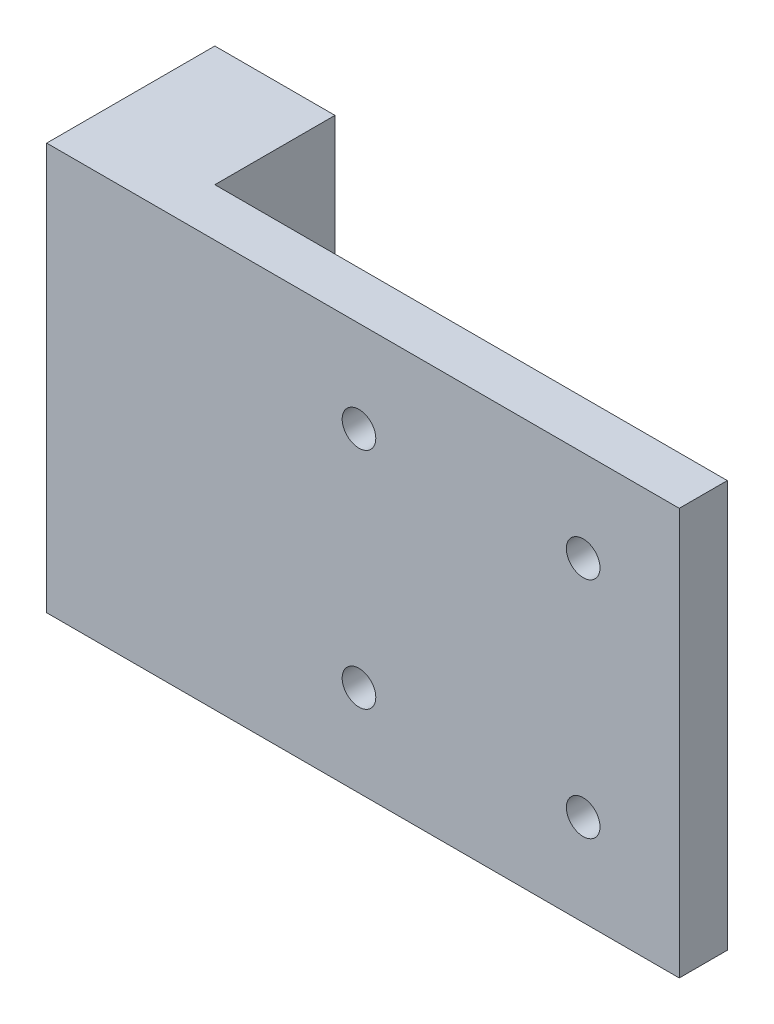
from build123d import *

# Parameters (mm, degrees)
SKETCH1_W           = 79
SKETCH1_H           = 50.8
SKETCH1_R           = 2.1
BOSS_EXTRUDE1_DEPTH = 6
SKETCH3_W           = 15
SKETCH3_H           = 50.8
BOSS_EXTRUDE2_DEPTH = 15


with BuildPart() as part:
    # Sketch1 → Boss-Extrude1 (new body)
    with BuildSketch(Plane.XY):
        with Locations((39.5, 25.4)):
            Rectangle(SKETCH1_W, SKETCH1_H)
        with Locations((67, 39.4)):
            Circle(SKETCH1_R, mode=Mode.SUBTRACT)
        with Locations((67, 11.4)):
            Circle(SKETCH1_R, mode=Mode.SUBTRACT)
        with Locations((39, 39.4)):
            Circle(SKETCH1_R, mode=Mode.SUBTRACT)
        with Locations((39, 11.4)):
            Circle(SKETCH1_R, mode=Mode.SUBTRACT)
    extrude(amount=BOSS_EXTRUDE1_DEPTH)

    # Sketch3 → Boss-Extrude2 (add)
    with BuildSketch(Plane(origin=(0, 0, 0), x_dir=(-1, 0, 0), z_dir=(0, 0, -1))):
        with Locations((-7.5, 25.4)):
            Rectangle(SKETCH3_W, SKETCH3_H)
    extrude(amount=BOSS_EXTRUDE2_DEPTH)


solid = part.part
